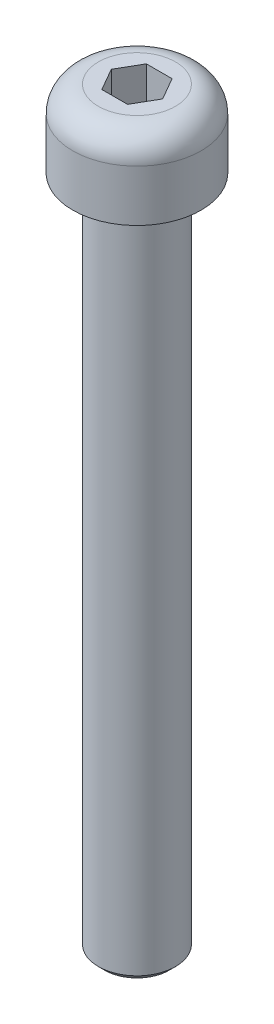
from build123d import *

# Parameters (mm, degrees)
SKETCH1_R           = 1.5
BOSS_EXTRUDE1_DEPTH = 26.25
SKETCH2_R           = 2.5
BOSS_EXTRUDE2_DEPTH = 3
FILLET1_R           = 1
CHAMFER1_SIZE       = 0.25
CUT_EXTRUDE1_DEPTH  = 2


with BuildPart() as part:
    # Sketch1 → Boss-Extrude1 (new body)
    with BuildSketch(Plane(origin=(0, 0, 0), x_dir=(1, 0, 0), z_dir=(0, 1, 0))):
        with Locations(Location((0, 0, 0), (0, 0, 270))):
            Circle(SKETCH1_R)
    extrude(amount=BOSS_EXTRUDE1_DEPTH)

    # Sketch2 → Boss-Extrude2 (add)
    with BuildSketch(Plane(origin=(0, 26.25, 0), x_dir=(1, 0, 0), z_dir=(0, 1, 0))):
        with Locations(Location((0, 0, 0), (0, 0, 270))):
            Circle(SKETCH2_R)
    extrude(amount=BOSS_EXTRUDE2_DEPTH)

    # Fillet1
    fillet1_edges = [part.edges().sort_by_distance(p)[0] for p in [
        (0, 29.25, -2.5),
    ]]
    fillet(fillet1_edges, radius=FILLET1_R)

    # Chamfer1
    chamfer1_edges = [part.edges().sort_by_distance(p)[0] for p in [
        (0, 0, -1.5),
    ]]
    chamfer(chamfer1_edges, length=CHAMFER1_SIZE)

    # Sketch3 → Cut-Extrude1 (cut)
    with BuildSketch(Plane(origin=(0, 29.25, 0), x_dir=(1, 0, 0), z_dir=(0, 1, 0))):
        Polygon((-1, 0), (-0.5, -0.866025404), (0.5, -0.866025404), (1, 0), (0.5, 0.866025404), (-0.5, 0.866025404), align=None)
    extrude(amount=-CUT_EXTRUDE1_DEPTH, mode=Mode.SUBTRACT)


solid = part.part
